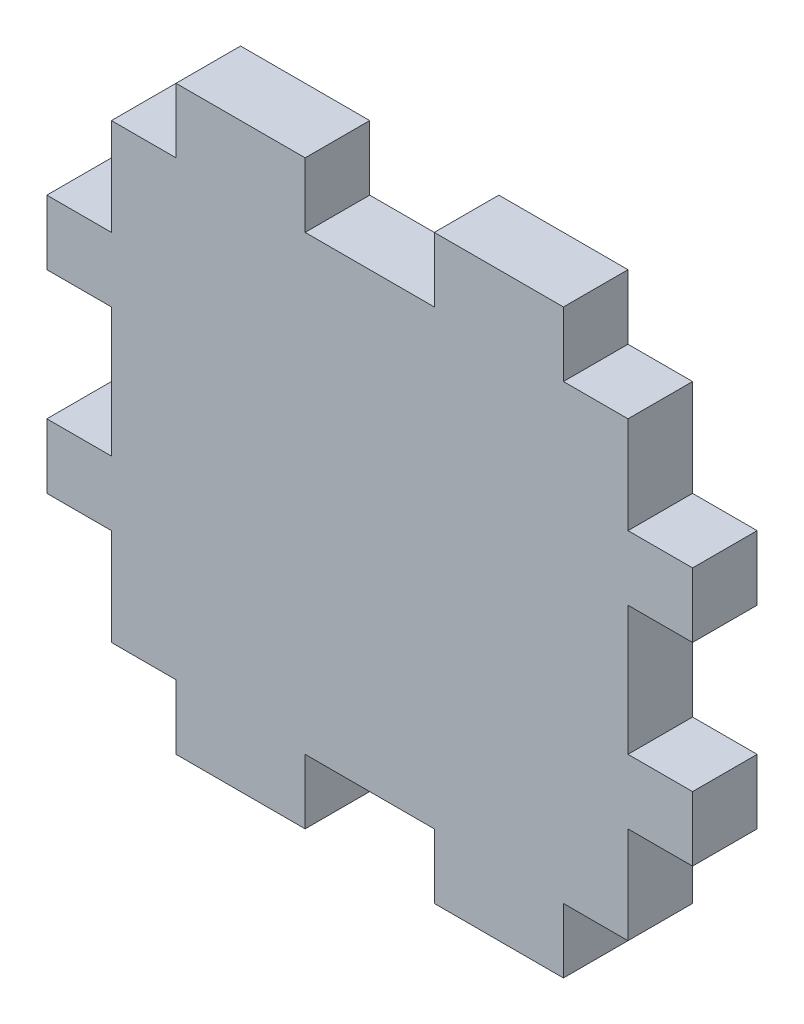
from build123d import *

# Parameters (mm, degrees)
EXTRUDE_1_DEPTH = 2


with BuildPart() as part:
    # Model → 凸台-拉伸1 (new body)
    with BuildSketch(Plane.XY):
        Polygon((1022.075950507, 566.466158611), (1022.075950507, 569.466158611), (1024.075950507, 569.466158611), (1024.075950507, 571.466158611), (1028.075950507, 571.466158611), (1028.075950507, 569.466158611), (1032.075950507, 569.466158611), (1032.075950507, 571.466158611), (1036.075950507, 571.466158611), (1036.075950507, 569.466158611), (1038.075950507, 569.466158611), (1038.075950507, 566.466158611), (1040.075950507, 566.466158611), (1040.075950507, 564.466158611), (1038.075950507, 564.466158611), (1038.075950507, 560.466158611), (1040.075950507, 560.466158611), (1040.075950507, 558.466158611), (1038.075950507, 558.466158611), (1038.075950507, 555.466158611), (1036.075950507, 555.466158611), (1036.075950507, 553.466158611), (1032.075950507, 553.466158611), (1032.075950507, 555.466158611), (1028.075950507, 555.466158611), (1028.075950507, 553.466158611), (1024.075950507, 553.466158611), (1024.075950507, 555.466158611), (1022.075950507, 555.466158611), (1022.075950507, 558.466158611), (1020.075950507, 558.466158611), (1020.075950507, 560.466158611), (1022.075950507, 560.466158611), (1022.075950507, 564.466158611), (1020.075950507, 564.466158611), (1020.075950507, 566.466158611), align=None)
    extrude(amount=EXTRUDE_1_DEPTH)


solid = part.part
